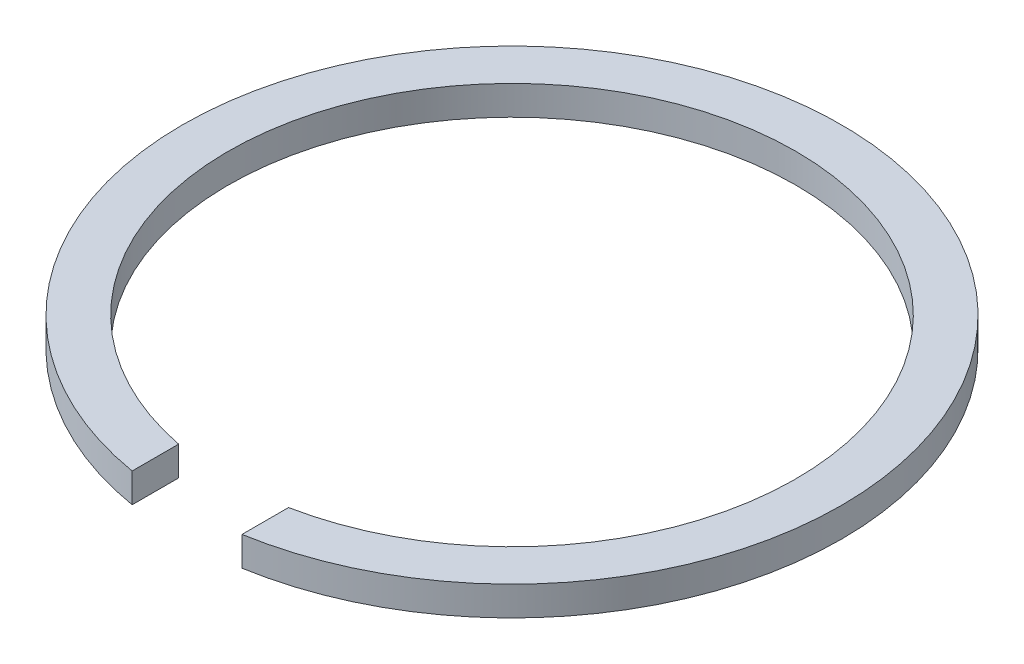
from build123d import *

# Parameters (mm, degrees)
BOSS_EXTRUDE1_DEPTH = 0.8


with BuildPart() as part:
    # Sketch1 → Boss-Extrude1 (new body)
    with BuildSketch(Plane(origin=(0, 0, 0), x_dir=(1, 0, 0), z_dir=(0, 1, 0))):
        with BuildLine():
            Line((1.5, -7.603453163), (1.5, -8.874119675))
            ThreePointArc((1.5, -8.874119675), (0, 9), (-1.5, -8.874119675))
            Line((-1.5, -8.874119675), (-1.5, -7.603453163))
            ThreePointArc((-1.5, -7.603453163), (0, 7.75), (1.5, -7.603453163))
        make_face()
    extrude(amount=BOSS_EXTRUDE1_DEPTH)


solid = part.part
